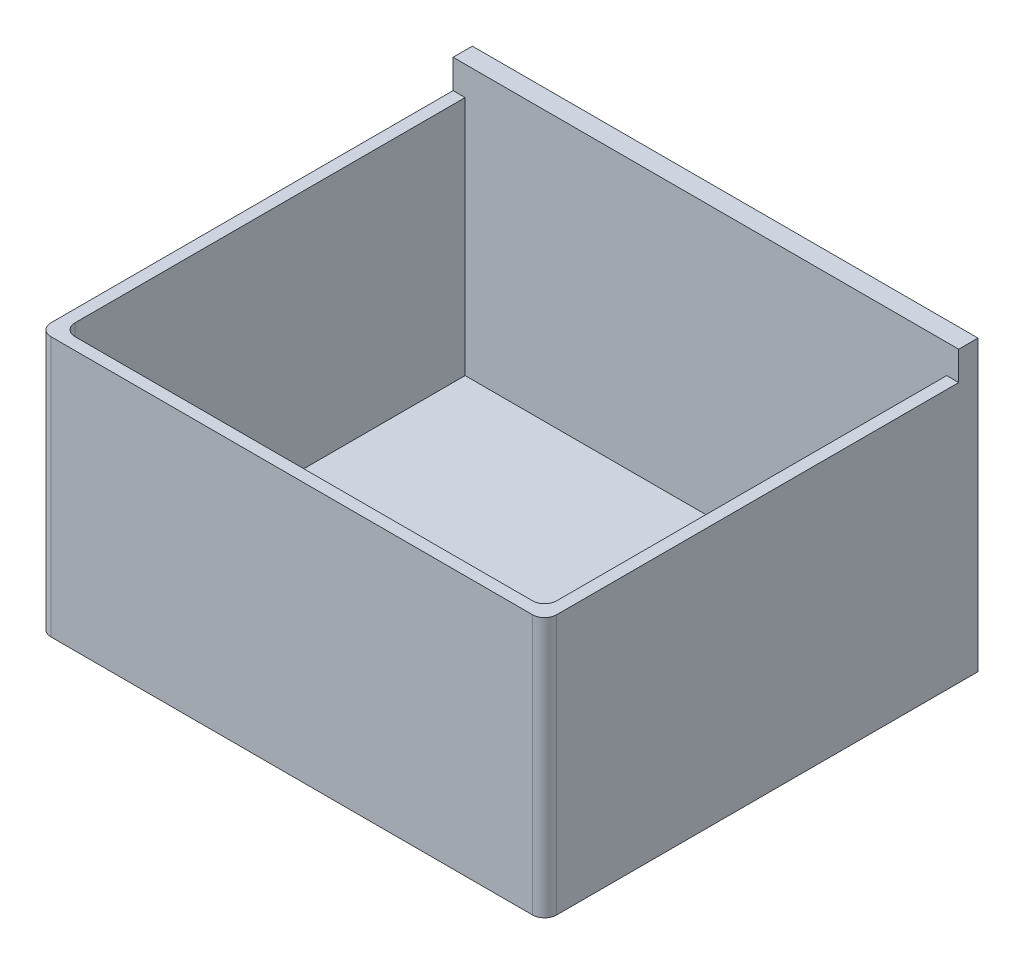
from build123d import *

# Parameters (mm, degrees)
BOSS_EXTRUDE1_DEPTH = 210
BOSS_EXTRUDE2_DEPTH = 100
SKETCH3_R           = 2.75
CUT_EXTRUDE1_DEPTH  = 20
FILLET1_R           = 5


with BuildPart() as part:
    # Sketch1 → Boss-Extrude1 (new body)
    with BuildSketch(Plane(origin=(0, 0, 0), x_dir=(0, 0, -1), z_dir=(1, 0, 0))):
        Polygon((0, 0), (0, 120), (-8, 120), (-8, 8), (-180, 8), (-180, 0), align=None)
    extrude(amount=BOSS_EXTRUDE1_DEPTH)

    # Sketch2 → Boss-Extrude2 (add)
    with BuildSketch(Plane(origin=(0, 8, 0), x_dir=(1, 0, 0), z_dir=(0, 1, 0))):
        Polygon((5, -8), (5, -175), (205, -175), (205, -8), (210, -8), (210, -180), (0, -180), (0, -8), align=None)
    extrude(amount=BOSS_EXTRUDE2_DEPTH)

    # Sketch3 → Cut-Extrude1 (cut)
    with BuildSketch(Plane.XZ):
        with Locations(Location((24, 140, 0), (0, 0, 270))):
            Circle(SKETCH3_R)
        with Locations(Location((81, 140, 0), (0, 0, 270))):
            Circle(SKETCH3_R)
        with Locations(Location((186, 140, 0), (0, 0, 270))):
            Circle(SKETCH3_R)
        with Locations(Location((129, 140, 0), (0, 0, 270))):
            Circle(SKETCH3_R)
    extrude(amount=-CUT_EXTRUDE1_DEPTH, mode=Mode.SUBTRACT)

    # Fillet1
    fillet1_edges = [part.edges().sort_by_distance(p)[0] for p in [
        (210, 54, 180),
        (205, 58, 175),
        (5, 58, 175),
        (0, 54, 180),
    ]]
    fillet(fillet1_edges, radius=FILLET1_R)


solid = part.part
